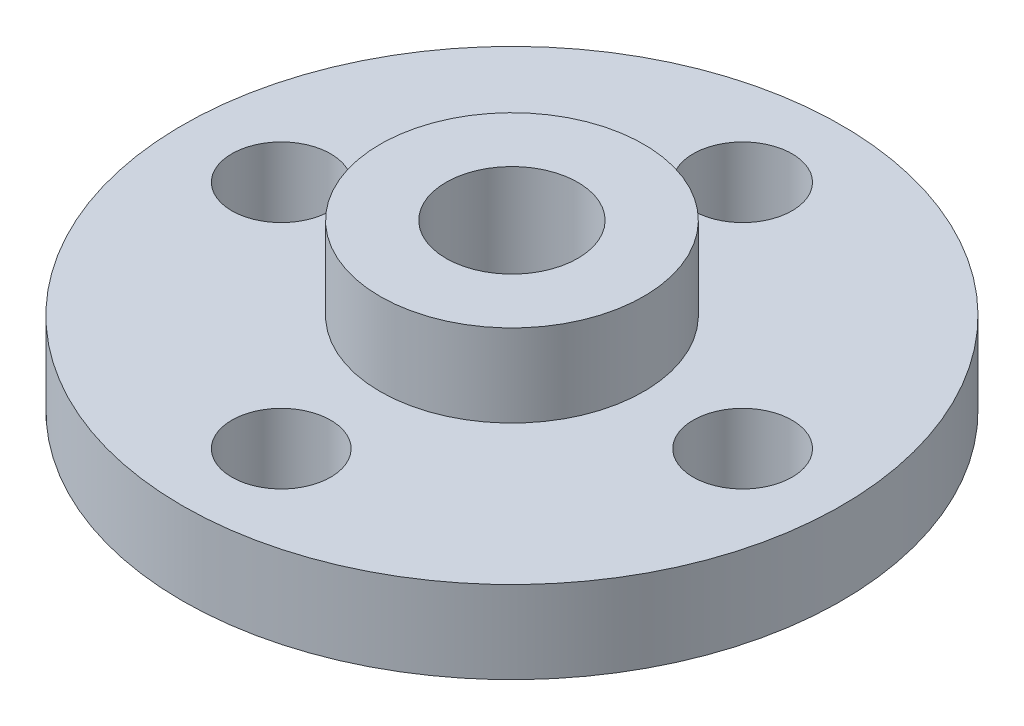
from build123d import *

# Parameters (mm, degrees)
SKETCH_1_R          = 10
SKETCH_1_R_2        = 2
EXTRUDE_1_DEPTH     = 2.5
SKETCH_2_R          = 4
SKETCH_2_R_2        = 2
EXTRUDE_2_DEPTH     = 2.5
SKETCH_3_R          = 1.5
CUT_EXTRUDE_1_DEPTH = 2.5


with BuildPart() as part:
    # 草图1 → 凸台-拉伸1 (new body)
    with BuildSketch(Plane(origin=(0, 0, 0), x_dir=(1, 0, 0), z_dir=(0, 1, 0))):
        with Locations(Location((0, 0, 0), (0, 0, 270))):
            Circle(SKETCH_1_R)
        with Locations(Location((0, 0, 0), (0, 0, 270))):
            Circle(SKETCH_1_R_2, mode=Mode.SUBTRACT)
    extrude(amount=EXTRUDE_1_DEPTH)

    # 草图2 → 凸台-拉伸2 (add)
    with BuildSketch(Plane(origin=(0, 2.5, 0), x_dir=(1, 0, 0), z_dir=(0, 1, 0))):
        with Locations(Location((0, 0, 0), (0, 0, 270))):
            Circle(SKETCH_2_R)
        with Locations(Location((0, 0, 0), (0, 0, 270))):
            Circle(SKETCH_2_R_2, mode=Mode.SUBTRACT)
    extrude(amount=EXTRUDE_2_DEPTH)

    # 草图3 → 切除-拉伸1 (cut)
    with BuildSketch(Plane(origin=(0, 2.5, 0), x_dir=(1, 0, 0), z_dir=(0, 1, 0))):
        with Locations(Location((0, 7, 0), (0, 0, 270))):
            Circle(SKETCH_3_R)
        with Locations(Location((7, 0, 0), (0, 0, 270))):
            Circle(SKETCH_3_R)
        with Locations(Location((0, -7, 0), (0, 0, 270))):
            Circle(SKETCH_3_R)
        with Locations(Location((-7, 0, 0), (0, 0, 270))):
            Circle(SKETCH_3_R)
    extrude(amount=-CUT_EXTRUDE_1_DEPTH, mode=Mode.SUBTRACT)


solid = part.part
